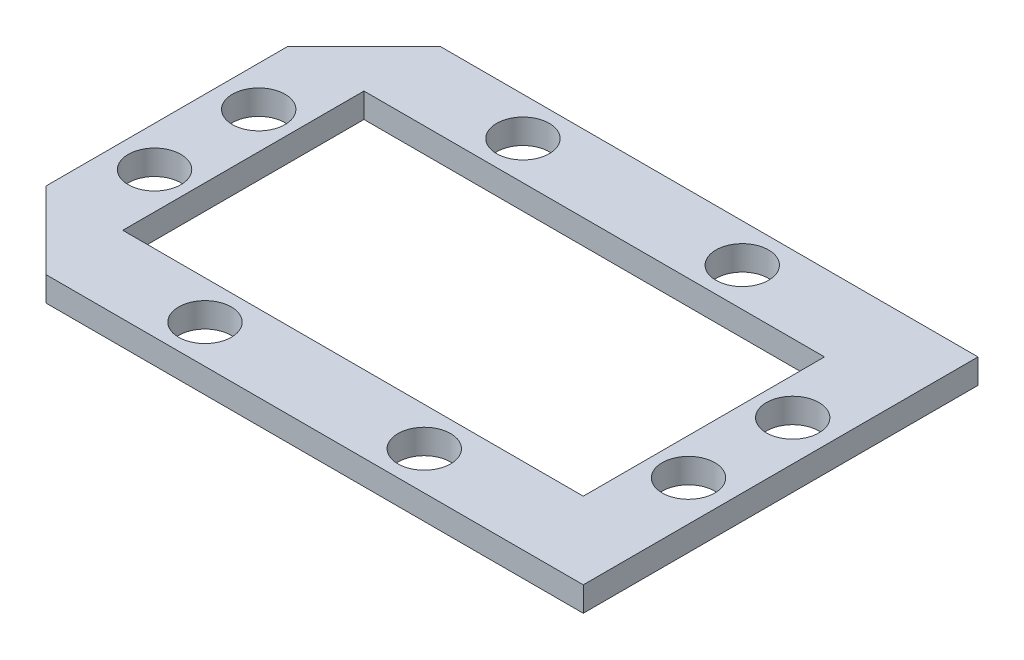
from build123d import *

# Parameters (mm, degrees)
SKETCH1_W           = 56
SKETCH1_H           = 36
SKETCH1_R           = 2.4
SKETCH1_W_2         = 42
SKETCH1_H_2         = 22
BOSS_EXTRUDE1_DEPTH = 2.25
CUT_EXTRUDE1_DEPTH  = 2.25


with BuildPart() as part:
    # Sketch1 → Boss-Extrude1 (new body)
    with BuildSketch(Plane(origin=(0, 0, 0), x_dir=(1, 0, 0), z_dir=(0, 1, 0))):
        Rectangle(SKETCH1_W, SKETCH1_H)
        with Locations(Location((24.35, -4.75, 0), (0, 0, 270))):
            Circle(SKETCH1_R, mode=Mode.SUBTRACT)
        with Locations(Location((24.35, 4.75, 0), (0, 0, 270))):
            Circle(SKETCH1_R, mode=Mode.SUBTRACT)
        with Locations(Location((-24.35, -4.75, 0), (0, 0, 270))):
            Circle(SKETCH1_R, mode=Mode.SUBTRACT)
        with Locations(Location((-24.35, 4.75, 0), (0, 0, 270))):
            Circle(SKETCH1_R, mode=Mode.SUBTRACT)
        with Locations(Location((10, 14.5, 0), (0, 0, 270))):
            Circle(SKETCH1_R, mode=Mode.SUBTRACT)
        with Locations(Location((10, -14.5, 0), (0, 0, 270))):
            Circle(SKETCH1_R, mode=Mode.SUBTRACT)
        with Locations(Location((-10, -14.5, 0), (0, 0, 270))):
            Circle(SKETCH1_R, mode=Mode.SUBTRACT)
        with Locations(Location((-10, 14.5, 0), (0, 0, 270))):
            Circle(SKETCH1_R, mode=Mode.SUBTRACT)
        Rectangle(SKETCH1_W_2, SKETCH1_H_2, mode=Mode.SUBTRACT)
    extrude(amount=BOSS_EXTRUDE1_DEPTH)

    # Sketch2 → Cut-Extrude1 (cut)
    with BuildSketch(Plane(origin=(0, 2.25, 0), x_dir=(1, 0, 0), z_dir=(0, 1, 0))):
        Polygon((-28, 11), (-21, 18), (-28, 18), align=None)
        Polygon((-21, -18), (-28, -11), (-28, -18), align=None)
    extrude(amount=-CUT_EXTRUDE1_DEPTH, mode=Mode.SUBTRACT)


solid = part.part
